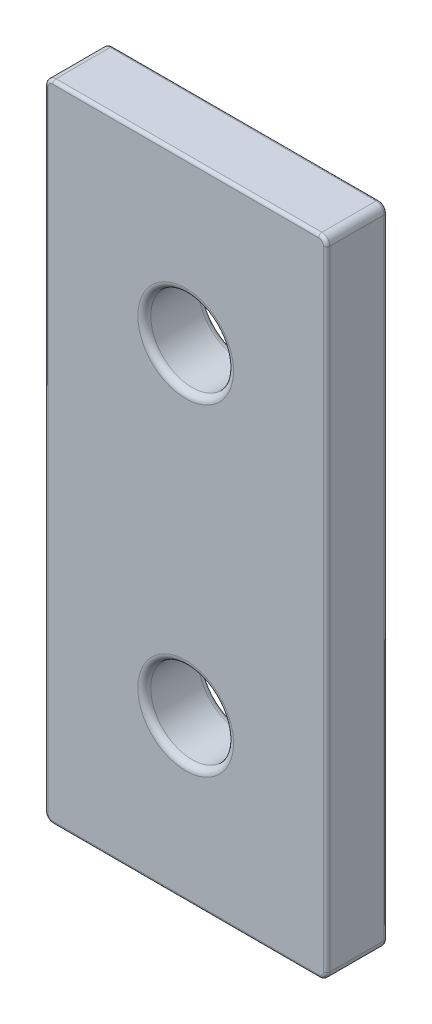
from build123d import *

# Parameters (mm, degrees)
BOSS_EXTRUDE1_START  = -2.3876
SKETCH3_W            = 22.225
SKETCH3_H            = 50.8
BOSS_EXTRUDE1_DEPTH  = 4.7752
FILLET1_R            = 0.635
SKETCH4_R            = 3.2639
CUT_EXTRUDE1_DEPTH   = 29.132724562
LPATTERN1_COUNT      = 2
LPATTERN1_PITCH      = 25.4
LPATTERN1_COUNT_DIR2 = 2
LPATTERN1_PITCH_DIR2 = 25.4
FILLET2_R            = 0.254
FILLET3_R            = 0.508


with BuildPart() as part:
    # Sketch3 → Boss-Extrude1 (new body)
    with BuildSketch(Plane.XY.offset(BOSS_EXTRUDE1_START)):
        Rectangle(SKETCH3_W, SKETCH3_H)
    extrude(amount=BOSS_EXTRUDE1_DEPTH)

    # Fillet1
    fillet1_edges = [part.edges().sort_by_distance(p)[0] for p in [
        (11.1125, 25.4, 0),
        (11.1125, -25.4, 0),
        (-11.1125, -25.4, 0),
        (-11.1125, 25.4, 0),
    ]]
    fillet(fillet1_edges, radius=FILLET1_R)

    # Sketch4 → Cut-Extrude1 (cut, through all)
    with BuildSketch(Plane.XY.offset(2.3876)):
        with Locations((0, 12.7)):
            Circle(SKETCH4_R)
    cut_extrude1 = extrude(amount=-CUT_EXTRUDE1_DEPTH, mode=Mode.SUBTRACT)

    # LPattern1: Cut-Extrude1 2 × 2
    with Locations(*[(-j * LPATTERN1_PITCH_DIR2, -i * LPATTERN1_PITCH, 0) for i in range(LPATTERN1_COUNT) for j in range(LPATTERN1_COUNT_DIR2) if (i, j) != (0, 0)]):
        add(cut_extrude1, mode=Mode.SUBTRACT)

    # Fillet2
    fillet2_edges = [part.edges().sort_by_distance(p)[0] for p in [
        (11.1125, 0, -2.3876),
        (11.1125, 0, 2.3876),
        (0, 25.4, -2.3876),
        (0, -25.4, -2.3876),
        (-11.1125, 0, -2.3876),
        (10.926512806, 25.214012806, -2.3876),
        (-10.926512806, 25.214012806, -2.3876),
        (-10.926512806, -25.214012806, -2.3876),
        (10.926512806, -25.214012806, -2.3876),
        (0, -25.4, 2.3876),
        (0, 25.4, 2.3876),
        (-11.1125, 0, 2.3876),
        (10.926512806, 25.214012806, 2.3876),
        (-10.926512806, 25.214012806, 2.3876),
        (-10.926512806, -25.214012806, 2.3876),
        (10.926512806, -25.214012806, 2.3876),
    ]]
    fillet(fillet2_edges, radius=FILLET2_R)

    # Fillet3
    fillet3_edges = [part.edges().sort_by_distance(p)[0] for p in [
        (-3.2639, 12.7, -2.3876),
        (-3.2639, 12.7, 2.3876),
        (-3.2639, -12.7, -2.3876),
        (-3.2639, -12.7, 2.3876),
    ]]
    fillet(fillet3_edges, radius=FILLET3_R)


solid = part.part
